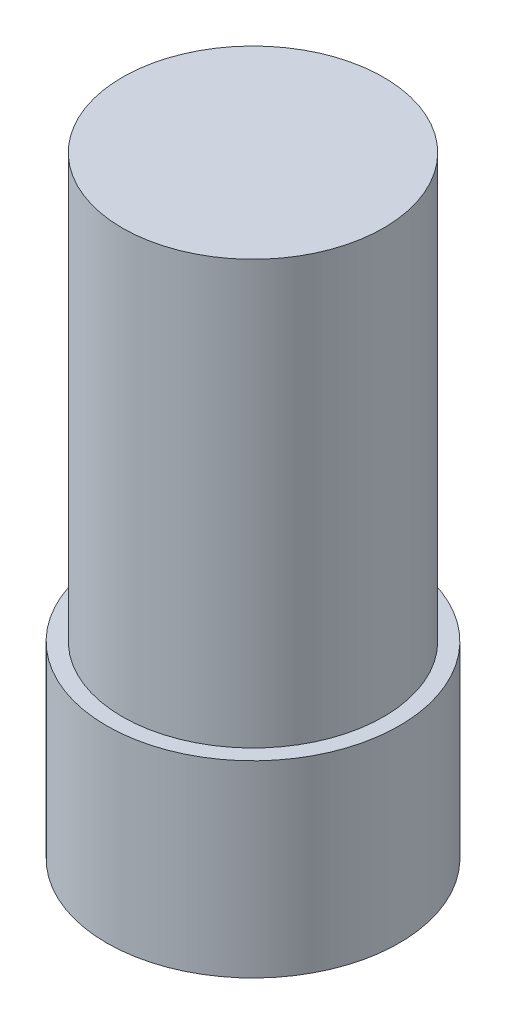
from build123d import *

# Parameters (mm, degrees)
SKETCH_1_R      = 14
EXTRUDE_1_DEPTH = 18
SKETCH_2_R      = 12.5
EXTRUDE_2_DEPTH = 40.5


with BuildPart() as part:
    # 草图1 → 凸台-拉伸1 (new body)
    with BuildSketch(Plane(origin=(0, 0, 0), x_dir=(1, 0, 0), z_dir=(0, 1, 0))):
        with Locations(Location((0, 0, 0), (0, 0, 270))):
            Circle(SKETCH_1_R)
    extrude(amount=EXTRUDE_1_DEPTH)

    # 草图2 → 凸台-拉伸2 (add)
    with BuildSketch(Plane(origin=(0, 18, 0), x_dir=(1, 0, 0), z_dir=(0, 1, 0))):
        with Locations(Location((0, 0, 0), (0, 0, 270))):
            Circle(SKETCH_2_R)
    extrude(amount=EXTRUDE_2_DEPTH)


solid = part.part
